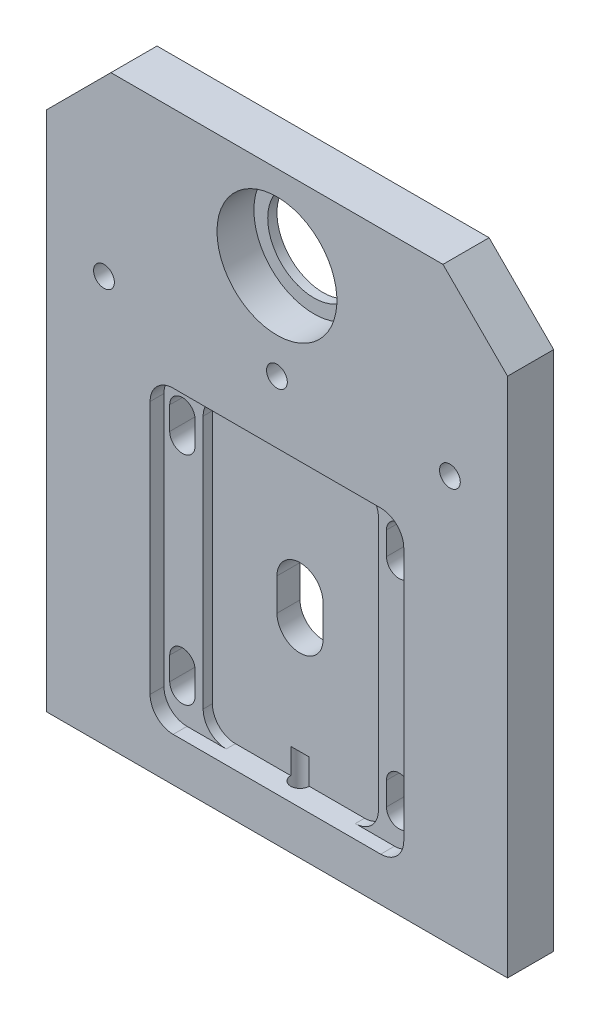
from build123d import *

# Parameters (mm, degrees)
ESTRUSIONE_ESTRUSIONE1_DEPTH = 10
SCHIZZO2_R                   = 10
TAGLIO_ESTRUSIONE1_DEPTH     = 10
SCHIZZO3_R                   = 2.25
TAGLIO_ESTRUSIONE2_DEPTH     = 10
TAGLIO_ESTRUSIONE3_DEPTH     = 3
TAGLIO_ESTRUSIONE4_DEPTH     = 2
TAGLIO_ESTRUSIONE5_DEPTH     = 162.721983663
TAGLIO_ESTRUSIONE6_DEPTH     = 162.796168063
SCHIZZO8_R                   = 13
TAGLIO_ESTRUSIONE7_DEPTH     = 8
SCHIZZO9_R                   = 4
TAGLIO_ESTRUSIONE8_DEPTH     = 4
SCHIZZO10_R                  = 2
TAGLIO_ESTRUSIONE9_DEPTH     = 15


with BuildPart() as part:
    # Schizzo1 → Estrusione-Estrusione1 (new body)
    with BuildSketch(Plane.XY):
        Polygon((0, 113), (14, 127), (86, 127), (100, 113), (100, 0), (0, 0), align=None)
    extrude(amount=-ESTRUSIONE_ESTRUSIONE1_DEPTH)

    # Schizzo2 → Taglio-Estrusione1 (cut)
    with BuildSketch(Plane.XY):
        with Locations((50, 108.7)):
            Circle(SCHIZZO2_R)
    extrude(amount=-TAGLIO_ESTRUSIONE1_DEPTH, mode=Mode.SUBTRACT)

    # Schizzo3 → Taglio-Estrusione2 (cut)
    with BuildSketch(Plane.XY):
        with Locations((12.5, 88)):
            Circle(SCHIZZO3_R)
        with Locations((50, 88)):
            Circle(SCHIZZO3_R)
        with Locations(Location((87.5, 88, 0), (0, 0, 180))):
            Circle(SCHIZZO3_R)
    extrude(amount=-TAGLIO_ESTRUSIONE2_DEPTH, mode=Mode.SUBTRACT)

    # Schizzo4 → Taglio-Estrusione3 (cut)
    with BuildSketch(Plane.XY):
        with BuildLine():
            Line((27.5, 74.5), (72.5, 74.5))
            ThreePointArc((72.5, 74.5), (76.035533906, 73.035533906), (77.5, 69.5))
            Line((77.5, 69.5), (77.5, 14.5))
            ThreePointArc((77.5, 14.5), (76.035533906, 10.964466094), (72.5, 9.5))
            Line((72.5, 9.5), (27.5, 9.5))
            ThreePointArc((27.5, 9.5), (23.964466094, 10.964466094), (22.5, 14.5))
            Line((22.5, 14.5), (22.5, 69.5))
            ThreePointArc((22.5, 69.5), (23.964466094, 73.035533906), (27.5, 74.5))
        make_face()
    extrude(amount=-TAGLIO_ESTRUSIONE3_DEPTH, mode=Mode.SUBTRACT)

    # Schizzo5 → Taglio-Estrusione4 (cut)
    with BuildSketch(Plane.XY.offset(-3)):
        with BuildLine():
            Line((36, 74.5), (64, 74.5))
            ThreePointArc((64, 74.5), (67.535533906, 73.035533906), (69, 69.5))
            Line((69, 69.5), (69, 14.5))
            ThreePointArc((69, 14.5), (67.535533906, 10.964466094), (64, 9.5))
            Line((64, 9.5), (36, 9.5))
            ThreePointArc((36, 9.5), (32.464466094, 10.964466094), (31, 14.5))
            Line((31, 14.5), (31, 69.5))
            ThreePointArc((31, 69.5), (32.464466094, 73.035533906), (36, 74.5))
        make_face()
    extrude(amount=-TAGLIO_ESTRUSIONE4_DEPTH, mode=Mode.SUBTRACT)

    # Schizzo6 → Taglio-Estrusione5 (cut, through all)
    with BuildSketch(Plane.XY.offset(-5)):
        with BuildLine():
            Line((54.993239352, 45.5), (54.993239352, 38.5))
            ThreePointArc((54.993239352, 38.5), (50, 33.506760648), (45.006760648, 38.5))
            Line((45.006760648, 38.5), (45.006760648, 45.5))
            ThreePointArc((45.006760648, 45.5), (50, 50.493239352), (54.993239352, 45.5))
        make_face()
    extrude(amount=-TAGLIO_ESTRUSIONE5_DEPTH, mode=Mode.SUBTRACT)

    # Schizzo7 → Taglio-Estrusione6 (cut, through all)
    with BuildSketch(Plane.XY.offset(-3)):
        with BuildLine():
            Line((23.75, 63), (23.75, 68))
            ThreePointArc((23.75, 68), (26.5, 70.75), (29.25, 68))
            Line((29.25, 68), (29.25, 63))
            ThreePointArc((29.25, 63), (26.5, 60.25), (23.75, 63))
        make_face()
        with BuildLine():
            Line((70.75, 63), (70.75, 68))
            ThreePointArc((70.75, 68), (73.5, 70.75), (76.25, 68))
            Line((76.25, 68), (76.25, 63))
            ThreePointArc((76.25, 63), (73.5, 60.25), (70.75, 63))
        make_face()
        with BuildLine():
            Line((23.75, 16), (23.75, 21))
            ThreePointArc((23.75, 21), (26.5, 23.75), (29.25, 21))
            Line((29.25, 21), (29.25, 16))
            ThreePointArc((29.25, 16), (26.5, 13.25), (23.75, 16))
        make_face()
        with BuildLine():
            Line((70.75, 16), (70.75, 21))
            ThreePointArc((70.75, 21), (73.5, 23.75), (76.25, 21))
            Line((76.25, 21), (76.25, 16))
            ThreePointArc((76.25, 16), (73.5, 13.25), (70.75, 16))
        make_face()
    extrude(amount=-TAGLIO_ESTRUSIONE6_DEPTH, mode=Mode.SUBTRACT)

    # Schizzo8 → Taglio-Estrusione7 (cut)
    with BuildSketch(Plane(origin=(0, 0, 0), x_dir=(-1, 0, 0), z_dir=(0, 0, -1))):
        with Locations((-50, 108.7)):
            Circle(SCHIZZO8_R)
    extrude(amount=TAGLIO_ESTRUSIONE7_DEPTH, mode=Mode.SUBTRACT)

    # Schizzo9 → Taglio-Estrusione8 (cut)
    with BuildSketch(Plane(origin=(0, 0, -10), x_dir=(-1, 0, 0), z_dir=(0, 0, -1))):
        with Locations((-85, 83)):
            Circle(SCHIZZO9_R)
        with Locations((-50, 88)):
            Circle(SCHIZZO9_R)
        with Locations((-12.5, 88)):
            Circle(SCHIZZO9_R)
    extrude(amount=-TAGLIO_ESTRUSIONE8_DEPTH, mode=Mode.SUBTRACT)

    # Schizzo10 → Taglio-Estrusione9 (cut)
    with BuildSketch(Plane.XZ):
        with Locations(Location((50, -5, 0), (0, 0, 270))):
            Circle(SCHIZZO10_R)
        with Locations(Location((19.5, -5, 0), (0, 0, 270))):
            Circle(SCHIZZO10_R)
        with Locations(Location((80.5, -5, 0), (0, 0, 90))):
            Circle(SCHIZZO10_R)
    extrude(amount=-TAGLIO_ESTRUSIONE9_DEPTH, mode=Mode.SUBTRACT)


solid = part.part
